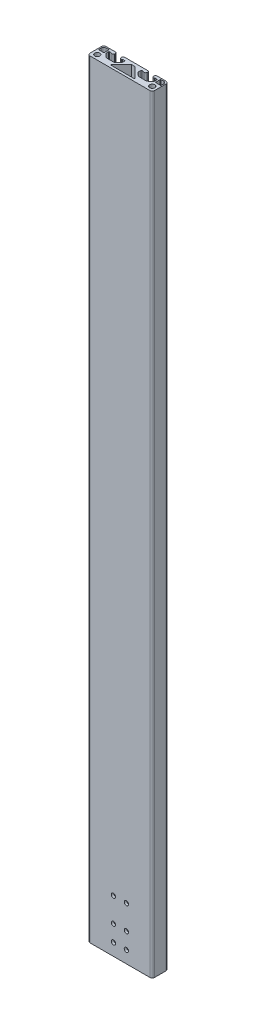
from build123d import *

# Parameters (mm, degrees)
SKETCH1_R                = 3.175
BOSS_EXTRUDE1_DEPTH      = 950
M5_CLEARANCE_HOLE1_D     = 5.3
M5_CLEARANCE_HOLE1_DEPTH = 5
M5_CLEARANCE_HOLE1_TIP   = 1.59228064


with BuildPart() as part:
    # Sketch1 → Boss-Extrude1 (new body)
    with BuildSketch(Plane.XZ):
        with BuildLine():
            Line((77, 0), (3, 0))
            ThreePointArc((3, 0), (0.878679656, -0.878679656), (0, -3))
            Line((0, -3), (0, -17))
            ThreePointArc((0, -17), (0.878679656, -19.121320344), (3, -20))
            Line((3, -20), (14.5, -20))
            ThreePointArc((14.5, -20), (15.560660172, -19.560660172), (16, -18.5))
            Line((16, -18.5), (16, -17.5))
            ThreePointArc((16, -17.5), (15.560660172, -16.439339828), (14.5, -16))
            Line((14.5, -16), (13.2, -16))
            Line((13.2, -16), (13.2, -16.5))
            Line((13.2, -16.5), (10.75, -16.5))
            ThreePointArc((10.75, -16.5), (10.219669914, -16.280330086), (10, -15.75))
            Line((10, -15.75), (10, -12.810660172))
            ThreePointArc((10, -12.810660172), (10.057090351, -12.523647598), (10.219669914, -12.280330086))
            Line((10.219669914, -12.280330086), (13.108757211, -9.391242789))
            ThreePointArc((13.108757211, -9.391242789), (14.649768118, -8.361572221), (16.467514421, -8))
            Line((16.467514421, -8), (23.532485579, -8))
            ThreePointArc((23.532485579, -8), (25.350231882, -8.361572221), (26.891242789, -9.391242789))
            Line((26.891242789, -9.391242789), (29.780330086, -12.280330086))
            ThreePointArc((29.780330086, -12.280330086), (29.942909649, -12.523647598), (30, -12.810660172))
            Line((30, -12.810660172), (30, -15.75))
            ThreePointArc((30, -15.75), (29.780330086, -16.280330086), (29.25, -16.5))
            Line((29.25, -16.5), (26.8, -16.5))
            Line((26.8, -16.5), (26.8, -16))
            Line((26.8, -16), (25.5, -16))
            ThreePointArc((25.5, -16), (24.439339828, -16.439339828), (24, -17.5))
            Line((24, -17.5), (24, -18.5))
            ThreePointArc((24, -18.5), (24.439339828, -19.560660172), (25.5, -20))
            Line((25.5, -20), (54.5, -20))
            ThreePointArc((54.5, -20), (55.560660172, -19.560660172), (56, -18.5))
            Line((56, -18.5), (56, -17.5))
            ThreePointArc((56, -17.5), (55.560660172, -16.439339828), (54.5, -16))
            Line((54.5, -16), (53.2, -16))
            Line((53.2, -16), (53.2, -16.5))
            Line((53.2, -16.5), (50.75, -16.5))
            ThreePointArc((50.75, -16.5), (50.219669914, -16.280330086), (50, -15.75))
            Line((50, -15.75), (50, -12.810660172))
            ThreePointArc((50, -12.810660172), (50.057090351, -12.523647598), (50.219669914, -12.280330086))
            Line((50.219669914, -12.280330086), (53.108757211, -9.391242789))
            ThreePointArc((53.108757211, -9.391242789), (54.649768118, -8.361572221), (56.467514421, -8))
            Line((56.467514421, -8), (63.532485579, -8))
            ThreePointArc((63.532485579, -8), (65.350231882, -8.361572221), (66.891242789, -9.391242789))
            Line((66.891242789, -9.391242789), (69.780330086, -12.280330086))
            ThreePointArc((69.780330086, -12.280330086), (69.942909649, -12.523647598), (70, -12.810660172))
            Line((70, -12.810660172), (70, -15.75))
            ThreePointArc((70, -15.75), (69.780330086, -16.280330086), (69.25, -16.5))
            Line((69.25, -16.5), (66.8, -16.5))
            Line((66.8, -16.5), (66.8, -16))
            Line((66.8, -16), (65.5, -16))
            ThreePointArc((65.5, -16), (64.439339828, -16.439339828), (64, -17.5))
            Line((64, -17.5), (64, -18.5))
            ThreePointArc((64, -18.5), (64.439339828, -19.560660172), (65.5, -20))
            Line((65.5, -20), (77, -20))
            ThreePointArc((77, -20), (79.121320344, -19.121320344), (80, -17))
            Line((80, -17), (80, -3))
            ThreePointArc((80, -3), (79.121320344, -0.878679656), (77, 0))
        make_face()
        with Locations(Location((6, -6, 0), (0, 0, 270))):
            Circle(SKETCH1_R, mode=Mode.SUBTRACT)
        with Locations(Location((74, -6, 0), (0, 0, 270))):
            Circle(SKETCH1_R, mode=Mode.SUBTRACT)
        with BuildLine():
            Line((7.45, -18.5), (4.3, -18.5))
            ThreePointArc((4.3, -18.5), (2.320101013, -17.679898987), (1.5, -15.7))
            Line((1.5, -15.7), (1.5, -12.75))
            ThreePointArc((1.5, -12.75), (1.719669914, -12.219669914), (2.25, -12))
            Line((2.25, -12), (7.45, -12))
            ThreePointArc((7.45, -12), (7.980330086, -12.219669914), (8.2, -12.75))
            Line((8.2, -12.75), (8.2, -17.75))
            ThreePointArc((8.2, -17.75), (7.980330086, -18.280330086), (7.45, -18.5))
        make_face(mode=Mode.SUBTRACT)
        with BuildLine():
            Line((54.546446609, -3.853553391), (41.9, -16.5))
            Line((41.9, -16.5), (38.1, -16.5))
            Line((38.1, -16.5), (25.453553391, -3.853553391))
            ThreePointArc((25.453553391, -3.853553391), (25.345167015, -3.308658284), (25.807106781, -3))
            Line((25.807106781, -3), (54.192893219, -3))
            ThreePointArc((54.192893219, -3), (54.654832985, -3.308658284), (54.546446609, -3.853553391))
        make_face(mode=Mode.SUBTRACT)
        with BuildLine():
            Line((71.8, -17.75), (71.8, -12.75))
            ThreePointArc((71.8, -12.75), (72.019669914, -12.219669914), (72.55, -12))
            Line((72.55, -12), (77.75, -12))
            ThreePointArc((77.75, -12), (78.280330086, -12.219669914), (78.5, -12.75))
            Line((78.5, -12.75), (78.5, -15.7))
            ThreePointArc((78.5, -15.7), (77.679898987, -17.679898987), (75.7, -18.5))
            Line((75.7, -18.5), (72.55, -18.5))
            ThreePointArc((72.55, -18.5), (72.019669914, -18.280330086), (71.8, -17.75))
        make_face(mode=Mode.SUBTRACT)
    extrude(amount=-BOSS_EXTRUDE1_DEPTH)

    # M5 Clearance Hole1
    with Locations(Plane.XY):
        with Locations((48, 15), (48, 35), (48, 65), (32, 65), (32, 35), (32, 15)):
            Hole(M5_CLEARANCE_HOLE1_D / 2, depth=M5_CLEARANCE_HOLE1_DEPTH)
            with Locations((0, 0, -(M5_CLEARANCE_HOLE1_DEPTH + M5_CLEARANCE_HOLE1_TIP / 2))):  # 118° drill point
                Cone(0, M5_CLEARANCE_HOLE1_D / 2, M5_CLEARANCE_HOLE1_TIP, mode=Mode.SUBTRACT)


solid = part.part
